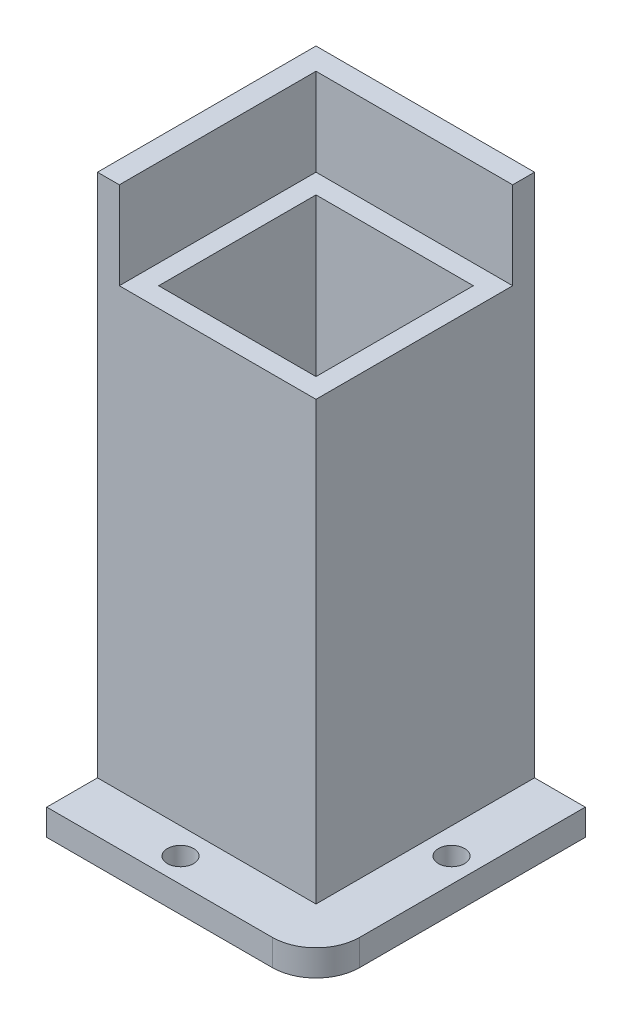
from build123d import *

# Parameters (mm, degrees)
SKETCH1_W           = 25
SKETCH1_H           = 25
BOSS_EXTRUDE1_DEPTH = 63
SKETCH2_W           = 22.5
SKETCH2_H           = 22.5
CUT_EXTRUDE2_DEPTH  = 10
SKETCH4_W           = 25
SKETCH4_H           = 25
SKETCH4_R           = 1.5
BOSS_EXTRUDE2_DEPTH = 3
SKETCH5_W           = 18
SKETCH5_H           = 18
CUT_EXTRUDE3_DEPTH  = 50


with BuildPart() as part:
    # Sketch1 → Boss-Extrude1 (new body)
    with BuildSketch(Plane(origin=(0, 0, 0), x_dir=(1, 0, 0), z_dir=(0, 1, 0))):
        Rectangle(SKETCH1_W, SKETCH1_H)
    extrude(amount=BOSS_EXTRUDE1_DEPTH)

    # Sketch2 → Cut-Extrude2 (cut)
    with BuildSketch(Plane(origin=(0, 63, 0), x_dir=(1, 0, 0), z_dir=(0, 1, 0))):
        with Locations((1.25, -1.25)):
            Rectangle(SKETCH2_W, SKETCH2_H)
    extrude(amount=-CUT_EXTRUDE2_DEPTH, mode=Mode.SUBTRACT)

    # Sketch4 → Boss-Extrude2 (add)
    # profile 1 of 2: a face of its own
    with BuildSketch(Plane.XZ):
        Rectangle(SKETCH4_W, SKETCH4_H)
    # profile 2 of 2: a face of its own
    with BuildSketch(Plane.XZ):
        with BuildLine():
            Line((12.5, 12.5), (12.5, -12.5))
            Line((12.5, -12.5), (18.3, -12.5))
            Line((18.3, -12.5), (18.3, 13.3))
            ThreePointArc((18.3, 13.3), (16.835533906, 16.835533906), (13.3, 18.3))
            Line((13.3, 18.3), (-12.5, 18.3))
            Line((-12.5, 18.3), (-12.5, 12.5))
            Line((-12.5, 12.5), (12.5, 12.5))
        make_face()
        with Locations(Location((15.5, 0, 0), (0, 0, 270))):
            Circle(SKETCH4_R, mode=Mode.SUBTRACT)
        with Locations(Location((0, 15.5, 0), (0, 0, 270))):
            Circle(SKETCH4_R, mode=Mode.SUBTRACT)
    extrude(amount=-BOSS_EXTRUDE2_DEPTH)

    # Sketch5 → Cut-Extrude3 (cut)
    with BuildSketch(Plane(origin=(0, 53, 0), x_dir=(1, 0, 0), z_dir=(0, 1, 0))):
        with Locations((1.25, -1.25)):
            Rectangle(SKETCH5_W, SKETCH5_H)
    extrude(amount=-CUT_EXTRUDE3_DEPTH, mode=Mode.SUBTRACT)


solid = part.part
